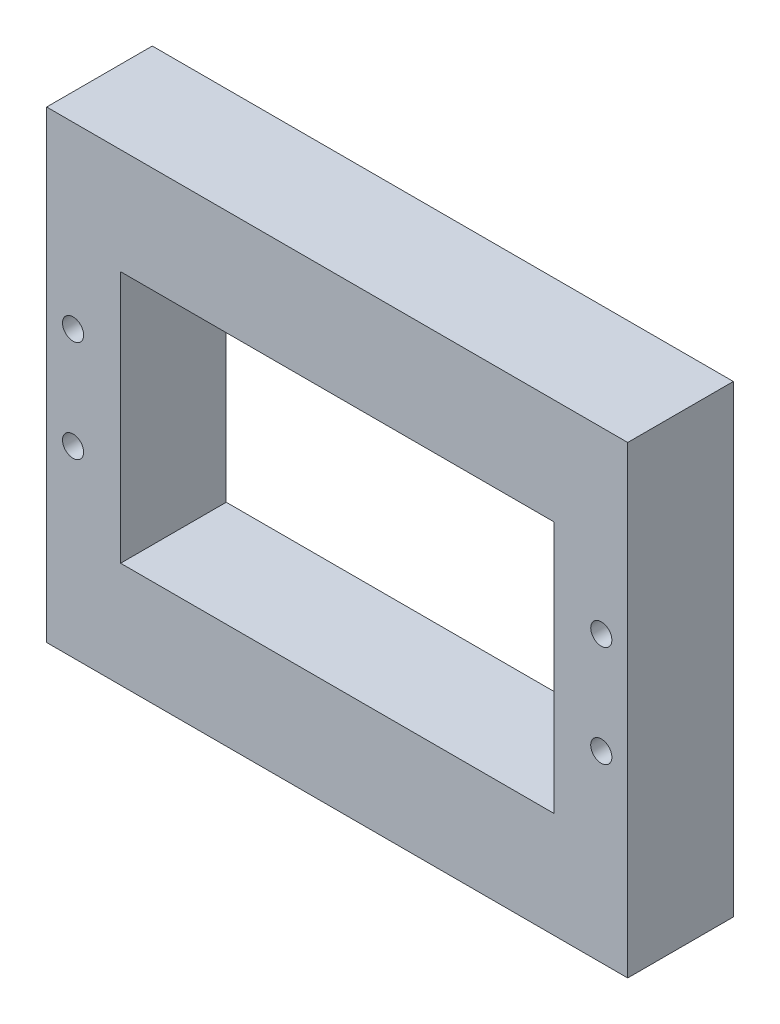
from build123d import *

# Parameters (mm, degrees)
SKETCH1_W           = 55
SKETCH1_H           = 10
BOSS_EXTRUDE1_DEPTH = 1
SKETCH2_W           = 7
SKETCH2_H           = 10
BOSS_EXTRUDE2_DEPTH = 23.9
CUT_EXTRUDE2_REACH  = 63.196
SKETCH4_R           = 1
SKETCH5_W           = 55
SKETCH5_H           = 10
BOSS_EXTRUDE3_DEPTH = 9
SKETCH6_W           = 55
SKETCH6_H           = 10
BOSS_EXTRUDE4_DEPTH = 10


with BuildPart() as part:
    # Sketch1 → Boss-Extrude1 (new body)
    with BuildSketch(Plane(origin=(0, 0, 0), x_dir=(1, 0, 0), z_dir=(0, 1, 0))):
        with Locations((27.5, 5)):
            Rectangle(SKETCH1_W, SKETCH1_H)
    extrude(amount=BOSS_EXTRUDE1_DEPTH)

    # Sketch2 → Boss-Extrude2 (add)
    with BuildSketch(Plane(origin=(0, 1, 0), x_dir=(1, 0, 0), z_dir=(0, 1, 0))):
        with Locations((51.5, 5)):
            Rectangle(SKETCH2_W, SKETCH2_H)
        with Locations((3.5, 5)):
            Rectangle(SKETCH2_W, SKETCH2_H)
    extrude(amount=BOSS_EXTRUDE2_DEPTH)

    # Sketch4 → Cut-Extrude2 (cut, up to next)
    with BuildSketch(Plane.XY, mode=Mode.PRIVATE) as cut_extrude2_sk1:
        with Locations((2.5, 17.95)):
            Circle(SKETCH4_R)
    cut_extrude2_tool1 = extrude(cut_extrude2_sk1.sketch, amount=-CUT_EXTRUDE2_REACH, mode=Mode.PRIVATE) & part.part
    # Sketch4 → Cut-Extrude2 (cut, up to next)
    with BuildSketch(Plane.XY, mode=Mode.PRIVATE) as cut_extrude2_sk2:
        with Locations((2.5, 8.35)):
            Circle(SKETCH4_R)
    cut_extrude2_tool2 = extrude(cut_extrude2_sk2.sketch, amount=-CUT_EXTRUDE2_REACH, mode=Mode.PRIVATE) & part.part
    # Sketch4 → Cut-Extrude2 (cut, up to next)
    with BuildSketch(Plane.XY, mode=Mode.PRIVATE) as cut_extrude2_sk3:
        with Locations((52.5, 8.35)):
            Circle(SKETCH4_R)
    cut_extrude2_tool3 = extrude(cut_extrude2_sk3.sketch, amount=-CUT_EXTRUDE2_REACH, mode=Mode.PRIVATE) & part.part
    # Sketch4 → Cut-Extrude2 (cut, up to next)
    with BuildSketch(Plane.XY, mode=Mode.PRIVATE) as cut_extrude2_sk4:
        with Locations((52.5, 17.95)):
            Circle(SKETCH4_R)
    cut_extrude2_tool4 = extrude(cut_extrude2_sk4.sketch, amount=-CUT_EXTRUDE2_REACH, mode=Mode.PRIVATE) & part.part
    add(cut_extrude2_tool1.solids().sort_by_distance((2.5, 17.95, 0))[0], mode=Mode.SUBTRACT)
    add(cut_extrude2_tool2.solids().sort_by_distance((2.5, 8.35, 0))[0], mode=Mode.SUBTRACT)
    add(cut_extrude2_tool3.solids().sort_by_distance((52.5, 8.35, 0))[0], mode=Mode.SUBTRACT)
    add(cut_extrude2_tool4.solids().sort_by_distance((52.5, 17.95, 0))[0], mode=Mode.SUBTRACT)

    # Sketch5 → Boss-Extrude3 (add)
    with BuildSketch(Plane.XZ):
        with Locations((27.5, -5)):
            Rectangle(SKETCH5_W, SKETCH5_H)
    extrude(amount=BOSS_EXTRUDE3_DEPTH)

    # Sketch6 → Boss-Extrude4 (add)
    with BuildSketch(Plane(origin=(0, 24.9, 0), x_dir=(1, 0, 0), z_dir=(0, 1, 0))):
        with Locations((27.5, 5)):
            Rectangle(SKETCH6_W, SKETCH6_H)
    extrude(amount=BOSS_EXTRUDE4_DEPTH)


solid = part.part
